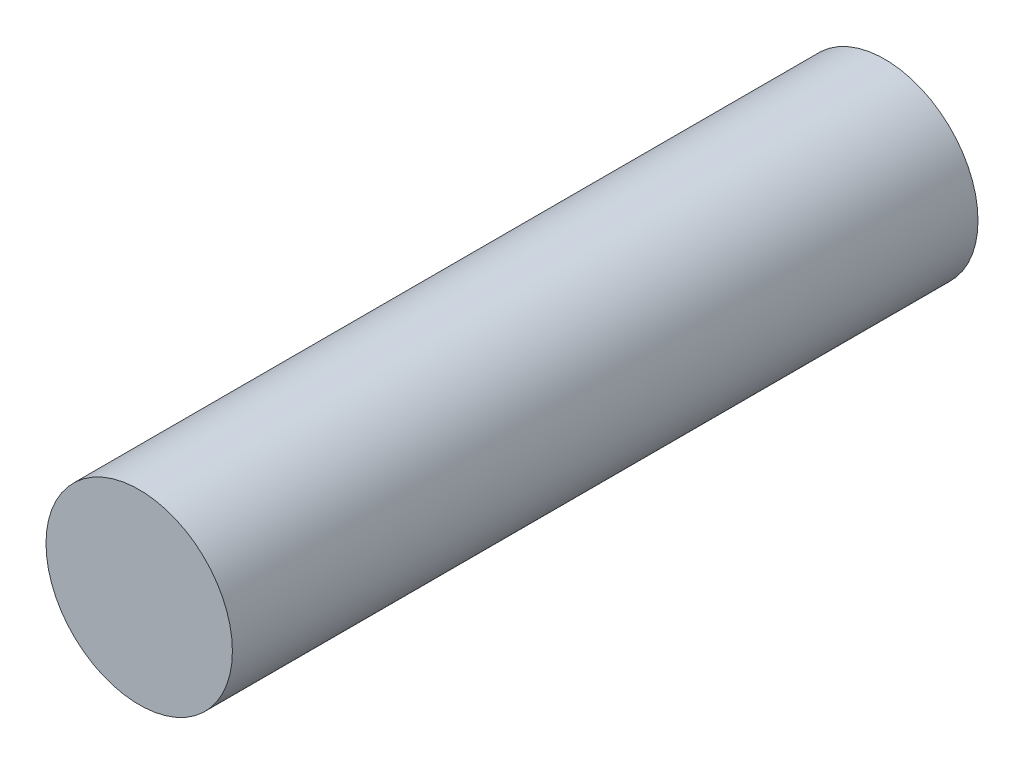
from build123d import *

# Parameters (mm, degrees)
PROFILE1_R = 5


with BuildPart() as part:
    # sweep_circle10_path40: sweep along a path in Path1
    with BuildLine(Plane(origin=(0, 0, 0), x_dir=(0, 0, -1), z_dir=(1, 0, 0))) as sweep_circle10_path40_path:
        Line((0, 0), (-40, 0))
    # Profile1 → sweep_circle10_path40 (sweep)
    with BuildSketch(Plane.XY):
        Circle(PROFILE1_R)
    sweep(path=sweep_circle10_path40_path.line)


solid = part.part
